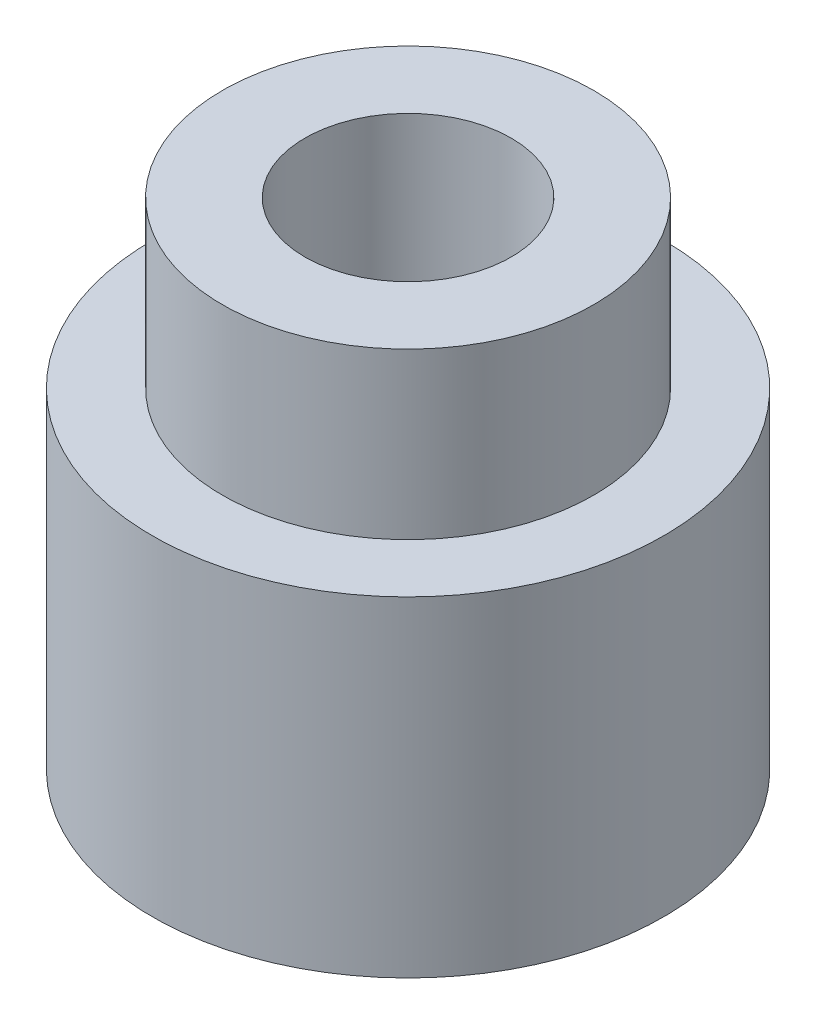
from build123d import *


with BuildPart() as part:
    # Sketch1 → Revolve1 (revolve)
    with BuildSketch(Plane(origin=(0, 0, 0), x_dir=(0, 0, -1), z_dir=(1, 0, 0)), mode=Mode.PRIVATE) as revolve1_sk:
        Polygon((-6.2, 0), (-6.2, 8), (-4.5, 8), (-4.5, 12), (-2.5, 12), (-2.5, 6), (-4.2, 6), (-4.2, 0), align=None)
    revolve(revolve1_sk.sketch.rotate(Axis((0, 0, 0), (0, 1, 0)), 180), axis=Axis((0, 0, 0), (0, 1, 0)))


solid = part.part
